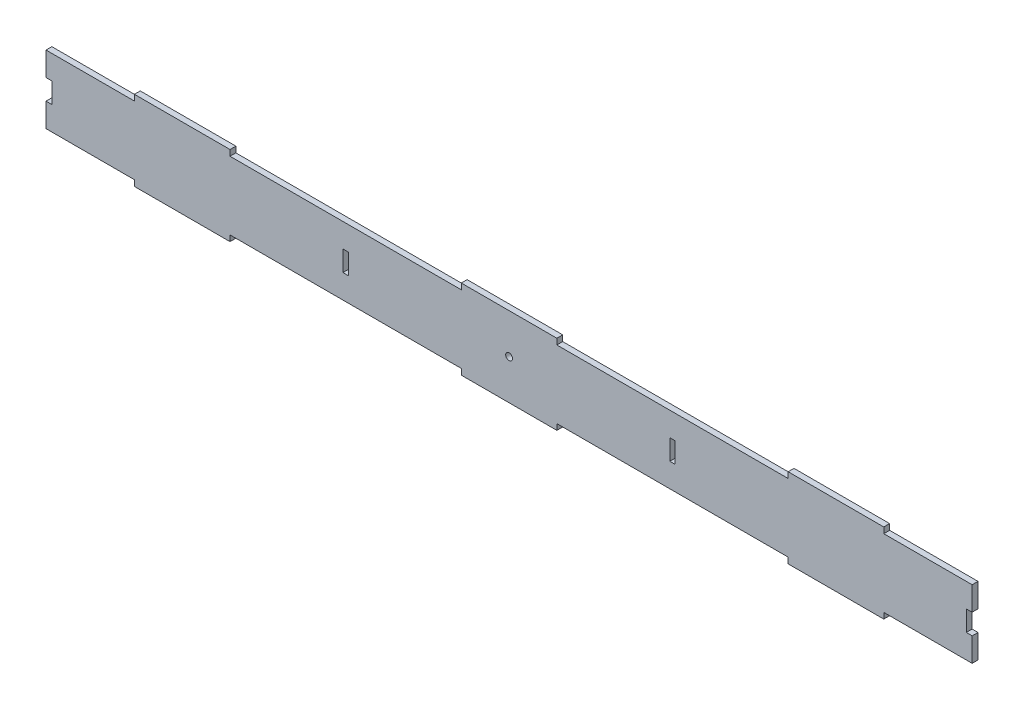
from build123d import *

# Parameters (mm, degrees)
SKETCH1_R           = 2.5
SKETCH1_W           = 4
SKETCH1_H           = 15
BOSS_EXTRUDE1_DEPTH = 4.3


with BuildPart() as part:
    # Sketch1 → Boss-Extrude1 (new body)
    with BuildSketch(Plane.XY):
        Polygon((-340, -25), (-275.1, -25), (-275.1, -29.3), (-204.9, -29.3), (-204.9, -25), (-35.1, -25), (-35.1, -29.3), (35.1, -29.3), (35.1, -25), (204.9, -25), (204.9, -29.3), (275.1, -29.3), (275.1, -25), (340, -25), (340, -7.5), (335.7, -7.5), (335.7, 7.5), (340, 7.5), (340, 25), (275.1, 25), (275.1, 29.3), (204.9, 29.3), (204.9, 25), (35.1, 25), (35.1, 29.3), (-35.1, 29.3), (-35.1, 25), (-204.9, 25), (-204.9, 29.3), (-275.1, 29.3), (-275.1, 25), (-340, 25), (-340, 7.5), (-335.7, 7.5), (-335.7, -7.5), (-340, -7.5), align=None)
        with Locations(Location((0, 0, 0), (0, 0, 180))):
            Circle(SKETCH1_R, mode=Mode.SUBTRACT)
        with Locations((120, 0)):
            Rectangle(SKETCH1_W, SKETCH1_H, mode=Mode.SUBTRACT)
        with Locations((-120, 0)):
            Rectangle(SKETCH1_W, SKETCH1_H, mode=Mode.SUBTRACT)
    extrude(amount=BOSS_EXTRUDE1_DEPTH)


solid = part.part
